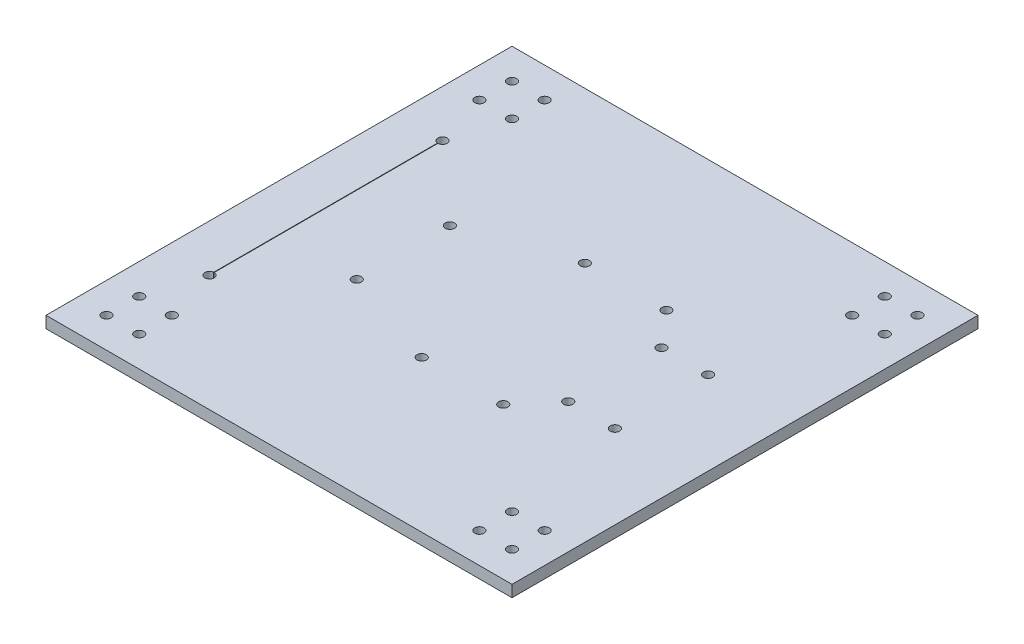
from build123d import *

# Parameters (mm, degrees)
SKETCH_1_W      = 200
SKETCH_1_H      = 200
SKETCH_1_R      = 2
EXTRUDE_2_DEPTH = 5


with BuildPart() as part:
    # 草图1 → 凸台-拉伸2 (new body)
    with BuildSketch(Plane(origin=(0, 0, 0), x_dir=(1, 0, 0), z_dir=(0, 1, 0))):
        Rectangle(SKETCH_1_W, SKETCH_1_H)
        with Locations(Location((-87, -87, 0), (0, 0, 270))):
            Circle(SKETCH_1_R, mode=Mode.SUBTRACT)
        with Locations(Location((-73, -87, 0), (0, 0, 270))):
            Circle(SKETCH_1_R, mode=Mode.SUBTRACT)
        with Locations(Location((-87, -73, 0), (0, 0, 270))):
            Circle(SKETCH_1_R, mode=Mode.SUBTRACT)
        with Locations(Location((-73, -73, 0), (0, 0, 270))):
            Circle(SKETCH_1_R, mode=Mode.SUBTRACT)
        with Locations(Location((-46.632517143, -20, 0), (0, 0, 270))):
            Circle(SKETCH_1_R, mode=Mode.SUBTRACT)
        with Locations(Location((-3.748020408, -35, 0), (0, 0, 270))):
            Circle(SKETCH_1_R, mode=Mode.SUBTRACT)
        with Locations(Location((73, -87, 0), (0, 0, 270))):
            Circle(SKETCH_1_R, mode=Mode.SUBTRACT)
        with Locations(Location((87, -87, 0), (0, 0, 270))):
            Circle(SKETCH_1_R, mode=Mode.SUBTRACT)
        with Locations(Location((73, -73, 0), (0, 0, 270))):
            Circle(SKETCH_1_R, mode=Mode.SUBTRACT)
        with Locations(Location((87, -73, 0), (0, 0, 270))):
            Circle(SKETCH_1_R, mode=Mode.SUBTRACT)
        with Locations(Location((31.251979592, -35, 0), (0, 0, 270))):
            Circle(SKETCH_1_R, mode=Mode.SUBTRACT)
        with Locations(Location((44.164957179, -20, 0), (0, 0, 270))):
            Circle(SKETCH_1_R, mode=Mode.SUBTRACT)
        with Locations(Location((64.164957179, -20, 0), (0, 0, 270))):
            Circle(SKETCH_1_R, mode=Mode.SUBTRACT)
        with BuildLine():
            Line((-79.805791506, 48), (-79.805791506, -48))
            ThreePointArc((-79.805791506, -48), (-79.708572332, -51.997635711), (-80, -48.009451568))
            Line((-80, -48.009451568), (-80, 48.009451568))
            ThreePointArc((-80, 48.009451568), (-79.708572332, 51.997635711), (-79.805791506, 48))
        make_face(mode=Mode.SUBTRACT)
        with Locations(Location((-46.632517143, 20, 0), (0, 0, 270))):
            Circle(SKETCH_1_R, mode=Mode.SUBTRACT)
        with Locations(Location((-3.748020408, 35, 0), (0, 0, 270))):
            Circle(SKETCH_1_R, mode=Mode.SUBTRACT)
        with Locations(Location((-87, 73, 0), (0, 0, 270))):
            Circle(SKETCH_1_R, mode=Mode.SUBTRACT)
        with Locations(Location((-73, 73, 0), (0, 0, 270))):
            Circle(SKETCH_1_R, mode=Mode.SUBTRACT)
        with Locations(Location((-87, 87, 0), (0, 0, 270))):
            Circle(SKETCH_1_R, mode=Mode.SUBTRACT)
        with Locations(Location((-73, 87, 0), (0, 0, 270))):
            Circle(SKETCH_1_R, mode=Mode.SUBTRACT)
        with Locations(Location((44.164957179, 20, 0), (0, 0, 270))):
            Circle(SKETCH_1_R, mode=Mode.SUBTRACT)
        with Locations(Location((31.251979592, 35, 0), (0, 0, 270))):
            Circle(SKETCH_1_R, mode=Mode.SUBTRACT)
        with Locations(Location((64.164957179, 20, 0), (0, 0, 270))):
            Circle(SKETCH_1_R, mode=Mode.SUBTRACT)
        with Locations(Location((73, 73, 0), (0, 0, 270))):
            Circle(SKETCH_1_R, mode=Mode.SUBTRACT)
        with Locations(Location((87, 73, 0), (0, 0, 270))):
            Circle(SKETCH_1_R, mode=Mode.SUBTRACT)
        with Locations(Location((73, 87, 0), (0, 0, 270))):
            Circle(SKETCH_1_R, mode=Mode.SUBTRACT)
        with Locations(Location((87, 87, 0), (0, 0, 270))):
            Circle(SKETCH_1_R, mode=Mode.SUBTRACT)
    extrude(amount=EXTRUDE_2_DEPTH)


solid = part.part
